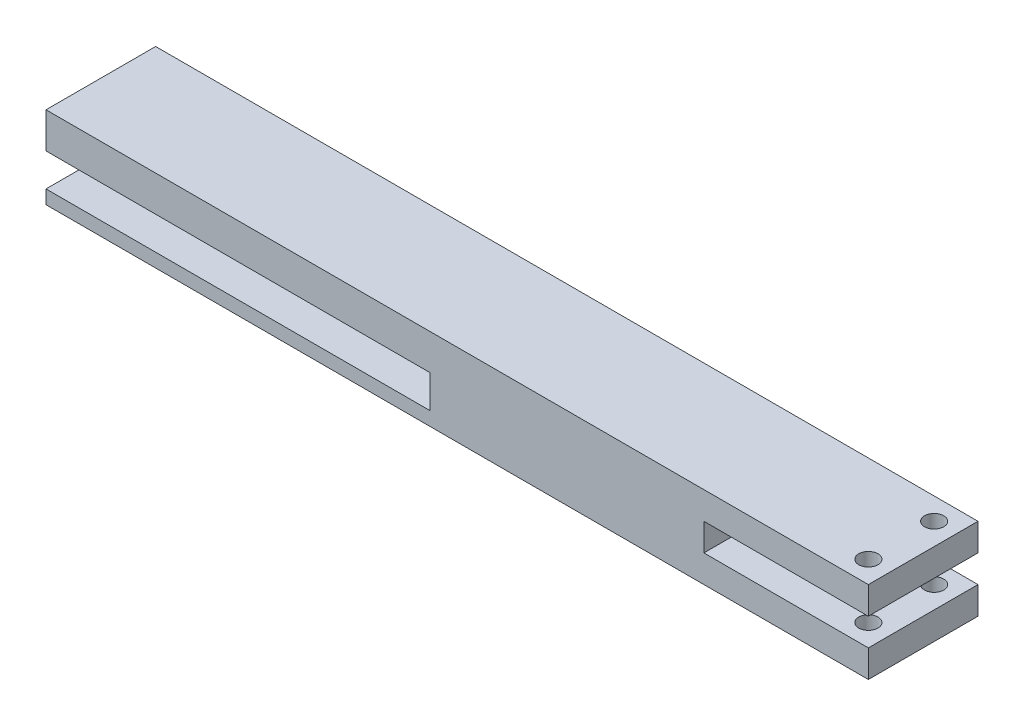
from build123d import *

# Parameters (mm, degrees)
SKETCH1_W           = 150
SKETCH1_H           = 20
BOSS_EXTRUDE3_DEPTH = 15
SKETCH11_W          = 70
SKETCH11_H          = 6
CUT_EXTRUDE5_DEPTH  = 85.961403002
SKETCH12_W          = 30
SKETCH12_H          = 5
CUT_EXTRUDE6_DEPTH  = 85.961403002
SKETCH13_R          = 1.75
CUT_EXTRUDE7_DEPTH  = 84.177160327


with BuildPart() as part:
    # Sketch1 → Boss-Extrude3 (new body)
    with BuildSketch(Plane(origin=(0, 0, 0), x_dir=(1, 0, 0), z_dir=(0, 1, 0))):
        with Locations((-6.2, 0)):
            Rectangle(SKETCH1_W, SKETCH1_H)
    extrude(amount=-BOSS_EXTRUDE3_DEPTH)

    # Sketch11 → Cut-Extrude5 (cut, through all)
    with BuildSketch(Plane.XY.offset(10)):
        with Locations((-46.2, -9.5)):
            Rectangle(SKETCH11_W, SKETCH11_H)
    extrude(amount=-CUT_EXTRUDE5_DEPTH, mode=Mode.SUBTRACT)

    # Sketch12 → Cut-Extrude6 (cut, through all)
    with BuildSketch(Plane.XY.offset(10)):
        with Locations((53.8, -7.5)):
            Rectangle(SKETCH12_W, SKETCH12_H)
    extrude(amount=-CUT_EXTRUDE6_DEPTH, mode=Mode.SUBTRACT)

    # Sketch13 → Cut-Extrude7 (cut, through all)
    with BuildSketch(Plane(origin=(0, 0, 0), x_dir=(1, 0, 0), z_dir=(0, 1, 0))):
        with Locations(Location((64.8, -6, 0), (0, 0, 270))):
            Circle(SKETCH13_R)
        with Locations(Location((64.8, 6, 0), (0, 0, 270))):
            Circle(SKETCH13_R)
    extrude(amount=-CUT_EXTRUDE7_DEPTH, mode=Mode.SUBTRACT)


solid = part.part
